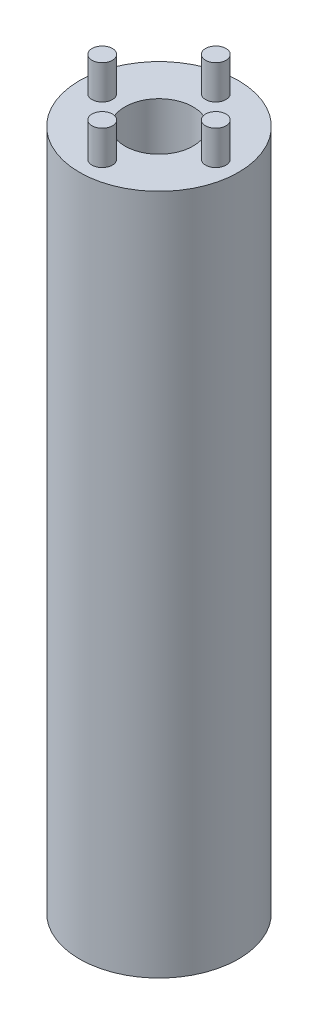
from build123d import *

# Parameters (mm, degrees)
SKETCH_1_R      = 3.5
SKETCH_1_R_2    = 1.5
EXTRUDE_2_DEPTH = 30
SKETCH_3_R      = 0.45
EXTRUDE_4_DEPTH = 1.5


with BuildPart() as part:
    # 草图1 → 凸台-拉伸2 (new body)
    with BuildSketch(Plane(origin=(0, 0, 0), x_dir=(1, 0, 0), z_dir=(0, 1, 0))):
        with Locations(Location((0, 0, 0), (0, 0, 270))):
            Circle(SKETCH_1_R)
        with Locations(Location((0, 0, 0), (0, 0, 270))):
            Circle(SKETCH_1_R_2, mode=Mode.SUBTRACT)
    extrude(amount=EXTRUDE_2_DEPTH)

    # 草图3 → 凸台-拉伸4 (add)
    with BuildSketch(Plane(origin=(0, 30, 0), x_dir=(1, 0, 0), z_dir=(0, 1, 0))):
        with Locations(Location((0, 2.5, 0), (0, 0, 270))):
            Circle(SKETCH_3_R)
        with Locations(Location((2.5, 0, 0), (0, 0, 270))):
            Circle(SKETCH_3_R)
        with Locations(Location((0, -2.5, 0), (0, 0, 270))):
            Circle(SKETCH_3_R)
        with Locations(Location((-2.5, 0, 0), (0, 0, 270))):
            Circle(SKETCH_3_R)
    extrude(amount=EXTRUDE_4_DEPTH)


solid = part.part
